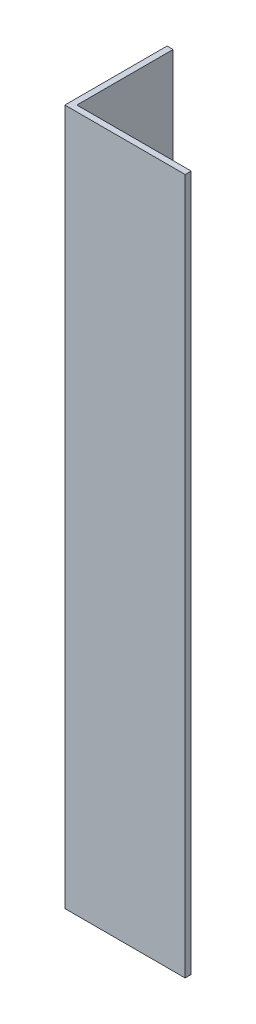
from build123d import *

# Parameters (mm, degrees)
SKETCH1_W           = 6.35
SKETCH1_H           = 734.741844671
BOSS_EXTRUDE1_DEPTH = 107.95
SKETCH2_W           = 6.35
SKETCH2_H           = 734.741844671
BOSS_EXTRUDE2_DEPTH = 120.65


with BuildPart() as part:
    # Sketch1 → Boss-Extrude1 (new body)
    with BuildSketch(Plane.XY):
        with Locations((-403.225, 89.829077665)):
            Rectangle(SKETCH1_W, SKETCH1_H)
    extrude(amount=BOSS_EXTRUDE1_DEPTH)

    # Sketch2 → Boss-Extrude2 (add)
    with BuildSketch(Plane(origin=(-400.05, 0, 0), x_dir=(0, 0, -1), z_dir=(1, 0, 0))):
        with Locations((-104.775, 89.829077665)):
            Rectangle(SKETCH2_W, SKETCH2_H)
    extrude(amount=BOSS_EXTRUDE2_DEPTH)


solid = part.part
